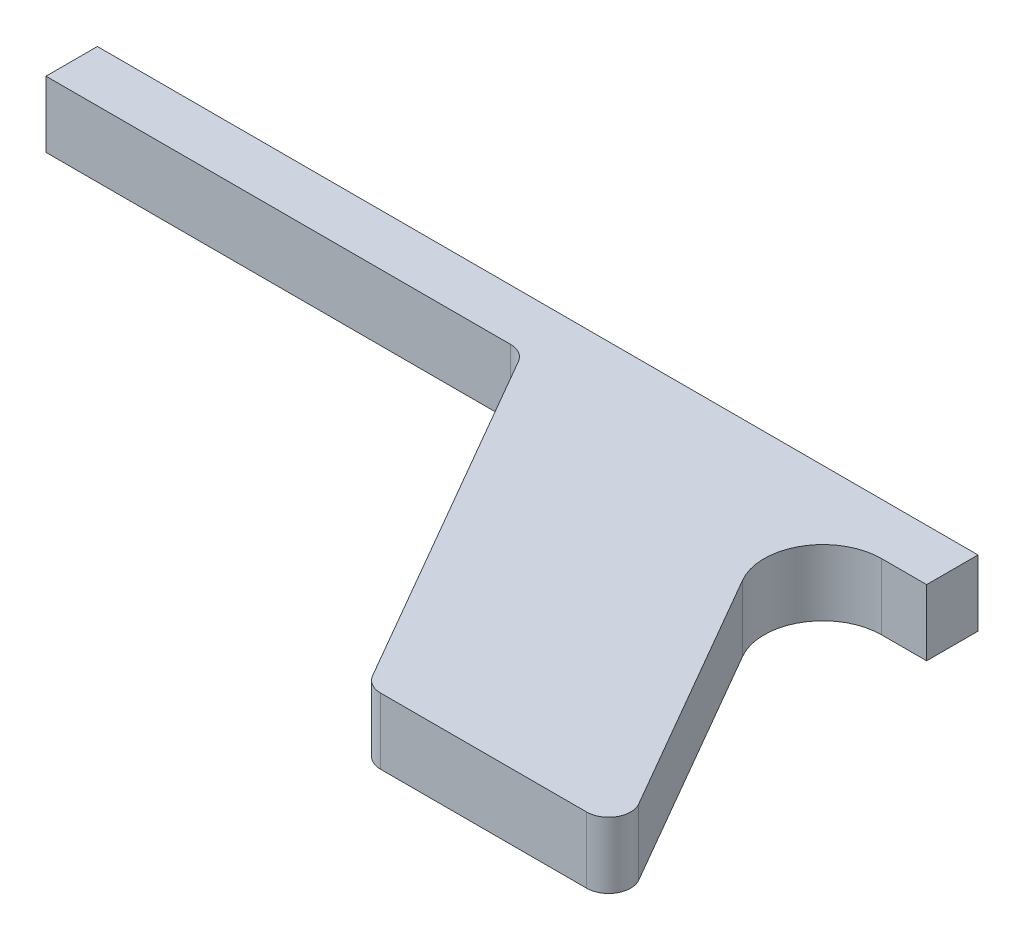
from build123d import *

# Parameters (mm, degrees)
BOSS_EXTRUDE1_DEPTH = 9
FILLET1_R           = 8
FILLET2_R           = 3


with BuildPart() as part:
    # Sketch1 → Boss-Extrude1 (new body)
    with BuildSketch(Plane(origin=(0, 0, 0), x_dir=(1, 0, 0), z_dir=(0, 1, 0))):
        Polygon((35, 0), (63.867513459, -50), (28.867513459, -50), (0, 0), align=None)
        Polygon((-65, 0), (0, 0), (35, 0), (55, 0), (55, 7), (-65, 7), align=None)
    extrude(amount=BOSS_EXTRUDE1_DEPTH)

    # Fillet1
    fillet1_edges = [part.edges().sort_by_distance(p)[0] for p in [
        (35, 4.5, 0),
    ]]
    fillet(fillet1_edges, radius=FILLET1_R)

    # Fillet2
    fillet2_edges = [part.edges().sort_by_distance(p)[0] for p in [
        (63.867513459, 4.5, 50),
        (28.867513459, 4.5, 50),
        (0, 4.5, 0),
    ]]
    fillet(fillet2_edges, radius=FILLET2_R)


solid = part.part
